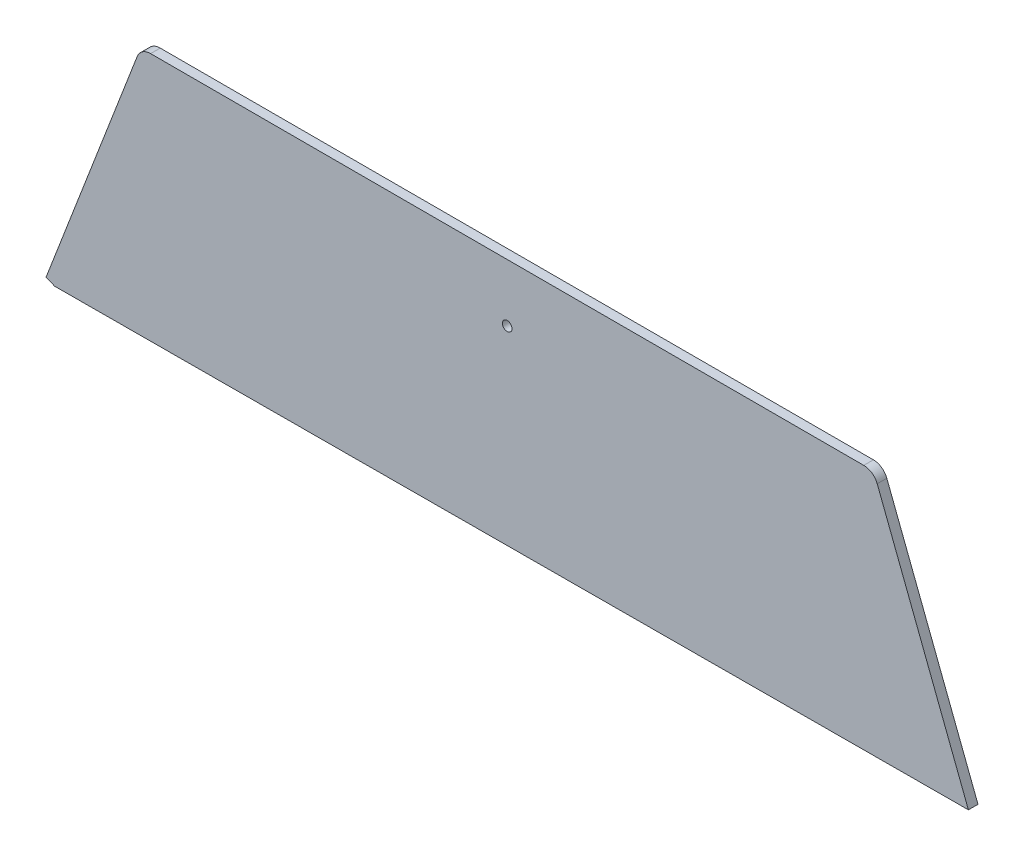
from build123d import *

# Parameters (mm, degrees)
BOSS_EXTRUDE1_DEPTH = 2
SKETCH2_R           = 1
CUT_EXTRUDE1_DEPTH  = 10


with BuildPart() as part:
    # Sketch1 → Boss-Extrude1 (new body)
    with BuildSketch(Plane.XY):
        with BuildLine():
            ThreePointArc((-75.246672681, -2.507158848), (-74.879445737, -2.042044212), (-74.313447388, -1.866450586))
            Line((-74.313447388, -1.866450586), (74.313447388, -1.866450586))
            ThreePointArc((74.313447388, -1.866450586), (74.955034485, -2.065494638), (75.371304372, -2.592725061))
            Line((75.371304372, -2.592725061), (94.116450586, -51.281416525))
            Line((94.116450586, -51.281416525), (-94.294779137, -51.982760032))
            Line((-94.294779137, -51.982760032), (-75.246672681, -2.507158848))
        make_face()
        with BuildLine():
            Line((-94.294779137, -51.982760032), (-75.246672681, -2.507158848))
            ThreePointArc((-75.246672681, -2.507158848), (-74.879445737, -2.042044212), (-74.313447388, -1.866450586))
            Line((-74.313447388, -1.866450586), (74.313447388, -1.866450586))
            ThreePointArc((74.313447388, -1.866450586), (74.955034485, -2.065494638), (75.371304372, -2.592725061))
            Line((75.371304372, -2.592725061), (94.116450586, -51.281416525))
            Line((94.116450586, -51.281416525), (96.116450586, -51.281416525))
            Line((96.116450586, -51.281416525), (77.113123267, -1.922124787))
            ThreePointArc((77.113123267, -1.922124787), (76.011442435, -0.526780879), (74.313447388, 0))
            Line((74.313447388, 0), (25, 0))
            Line((25, 0), (-25, 0))
            Line((-25, 0), (-74.313447388, 0))
            ThreePointArc((-74.313447388, 0), (-76.011442435, -0.526780879), (-77.113123267, -1.922124787))
            Line((-77.113123267, -1.922124787), (-96.116450586, -51.281416525))
            Line((-96.116450586, -51.281416525), (-94.294779137, -51.982760032))
        make_face()
    extrude(amount=BOSS_EXTRUDE1_DEPTH)

    # Sketch2 → Cut-Extrude1 (cut)
    with BuildSketch(Plane.XY.offset(2)):
        with Locations((0, -12)):
            Circle(SKETCH2_R)
    extrude(amount=-CUT_EXTRUDE1_DEPTH, mode=Mode.SUBTRACT)


solid = part.part
